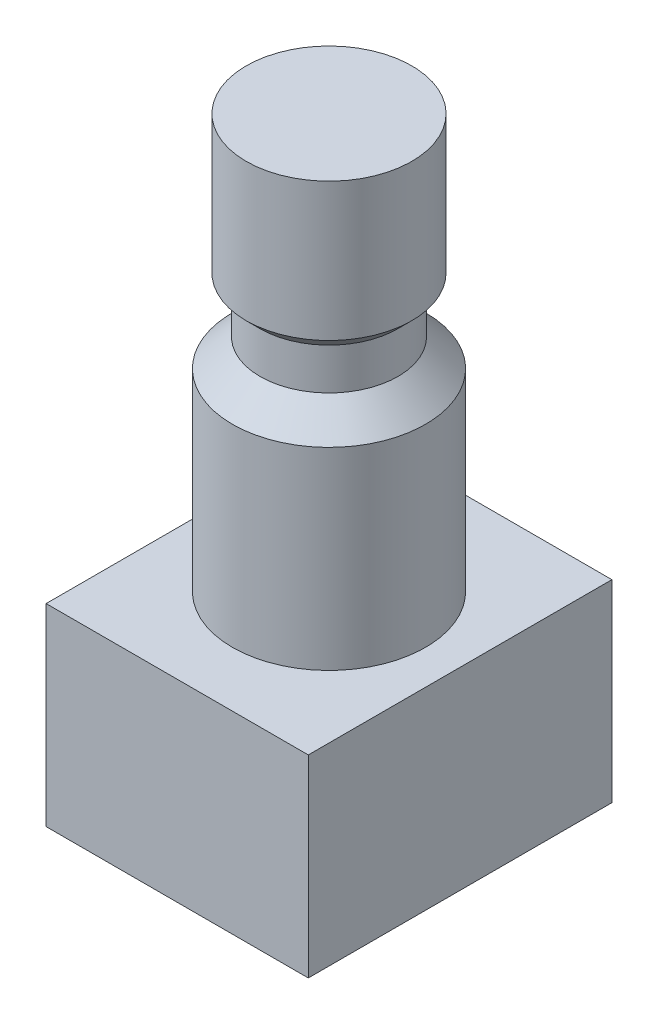
from build123d import *

# Parameters (mm, degrees)
ESQUISSE1_W        = 9.5
ESQUISSE1_H        = 11
BOSS_EXTRU_1_DEPTH = 7


with BuildPart() as part:
    # Esquisse1 → Boss.-Extru.1 (new body)
    with BuildSketch(Plane(origin=(0, 0, 0), x_dir=(1, 0, 0), z_dir=(0, 1, 0))):
        Rectangle(ESQUISSE1_W, ESQUISSE1_H)
    extrude(amount=-BOSS_EXTRU_1_DEPTH)

    # Esquisse3 → Révolution1 (revolve)
    with BuildSketch(Plane.XY, mode=Mode.PRIVATE) as r_volution1_sk:
        Polygon((0, 0), (0, 15), (3, 15), (3, 10), (2.5, 9.5), (2.5, 8), (3.5, 7), (3.5, 0), align=None)
    revolve(r_volution1_sk.sketch.rotate(Axis((0, 0, 0), (0, -1, 0)), 90), axis=Axis((0, 0, 0), (0, -1, 0)))


solid = part.part
